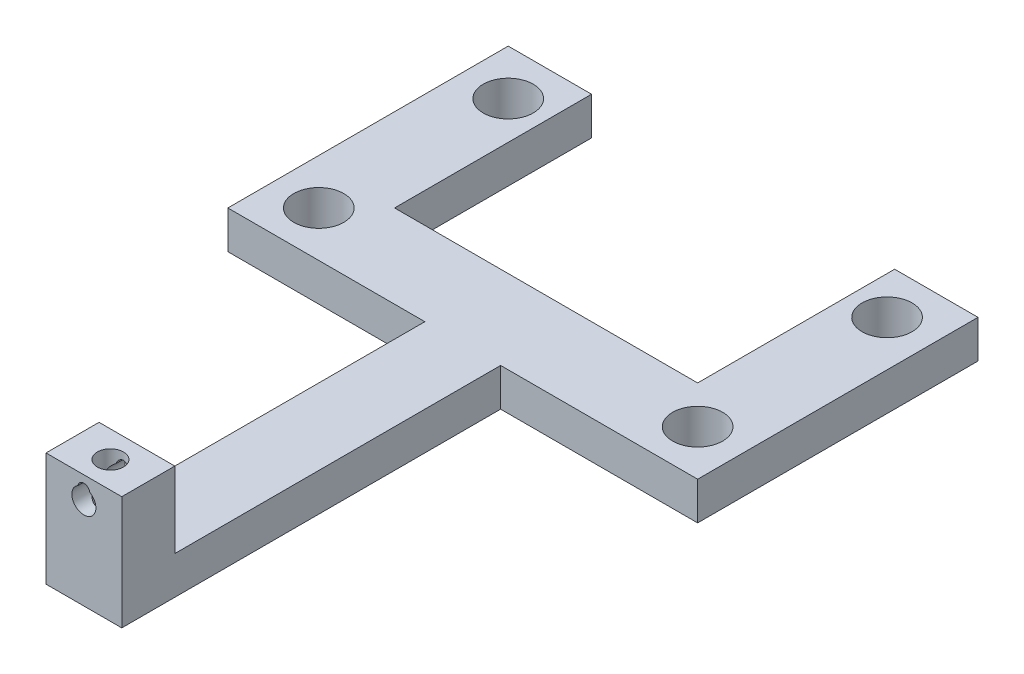
from build123d import *

# Parameters (mm, degrees)
EXTRUDE1_DEPTH                 = 5
LPATTERN1_COUNT                = 2
LPATTERN1_PITCH                = 50
LPATTERN1_COUNT_DIR2           = 2
LPATTERN1_PITCH_DIR2           = 25
SKETCH5_W                      = 10
SKETCH5_H                      = 5
EXTRUDE2_DEPTH                 = 50
SKETCH6_W                      = 10
SKETCH6_H                      = 7
EXTRUDE3_DEPTH                 = 10
F_1_8_0_125_DIAMETER_HOLE1_D   = 3.175
F_1_16_0_0625_DIAMETER_HOLE1_D = 1.5875
F_8_32_TAPPED_HOLE1_D          = 3.4544


with BuildPart() as part:
    # Sketch1 → Extrude1 (new body)
    with BuildSketch(Plane(origin=(0, 0, 0), x_dir=(1, 0, 0), z_dir=(0, 1, 0))):
        Polygon((-20, -7.5), (-20, 18.5), (-31, 18.5), (-31, -18.5), (31, -18.5), (31, 18.5), (20, 18.5), (20, -7.5), align=None)
    extrude(amount=EXTRUDE1_DEPTH)

    # Sketch4 → M6 Clearance Hole1 (revolve, cut)
    with BuildSketch(Plane(origin=(-25, 5, -12.5), x_dir=(0, 0, 1), z_dir=(1, 0, 0))):
        Polygon((0, 0), (0, 11.982840043), (3.3, 10), (3.3, 0), align=None)
    m6_clearance_hole1 = revolve(axis=Axis((-25, 11.35, -12.5), (0, -1, 0)), mode=Mode.SUBTRACT)

    # LPattern1: M6 Clearance Hole1 2 × 2
    with Locations(*[(i * LPATTERN1_PITCH, 0, j * LPATTERN1_PITCH_DIR2) for i in range(LPATTERN1_COUNT) for j in range(LPATTERN1_COUNT_DIR2) if (i, j) != (0, 0)]):
        add(m6_clearance_hole1, mode=Mode.SUBTRACT)

    # Sketch5 → Extrude2 (add)
    with BuildSketch(Plane.XY.offset(18.5)):
        with Locations((0, 2.5)):
            Rectangle(SKETCH5_W, SKETCH5_H)
    extrude(amount=EXTRUDE2_DEPTH)

    # Sketch6 → Extrude3 (add)
    with BuildSketch(Plane(origin=(0, 5, 0), x_dir=(1, 0, 0), z_dir=(0, 1, 0))):
        with Locations((0, -65)):
            Rectangle(SKETCH6_W, SKETCH6_H)
    extrude(amount=EXTRUDE3_DEPTH)

    # 1/8 (0.125) Diameter Hole1 (through all)
    with Locations(Plane(origin=(0, 12, 61.5), x_dir=(-1, 0, 0), z_dir=(0, 0, -1))):
        with Locations((0, 0)):
            Hole(F_1_8_0_125_DIAMETER_HOLE1_D / 2)

    # 1/16 (0.0625) Diameter Hole1 (through all)
    with Locations(Plane(origin=(0, 13.25, 61.5), x_dir=(-1, 0, 0), z_dir=(0, 0, -1))):
        with Locations((0, 0)):
            Hole(F_1_16_0_0625_DIAMETER_HOLE1_D / 2)

    # #8-32 Tapped Hole1 (through all)
    with Locations(Plane(origin=(0, 0, 65), x_dir=(0, 0, -1), z_dir=(0, -1, 0))):
        with Locations((0, 0)):
            Hole(F_8_32_TAPPED_HOLE1_D / 2)


solid = part.part
